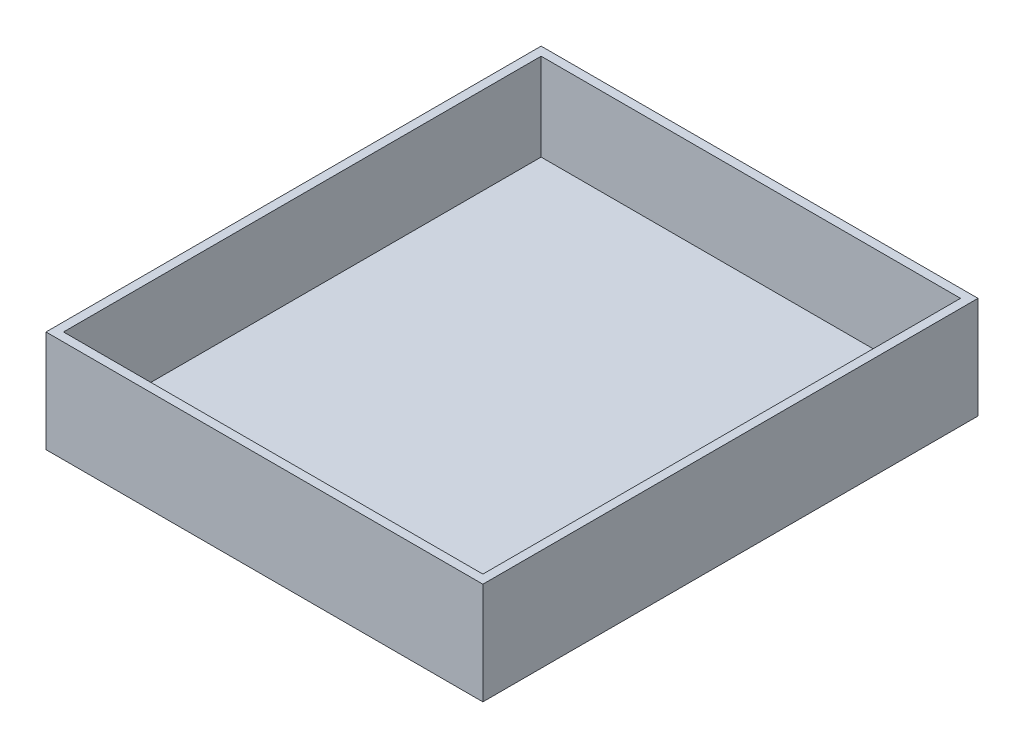
from build123d import *

# Parameters (mm, degrees)
SKETCH1_W           = 150
SKETCH1_H           = 170
BOSS_EXTRUDE1_DEPTH = 5
SKETCH3_W           = 150
SKETCH3_H           = 170
SKETCH3_W_2         = 144
SKETCH3_H_2         = 164
BOSS_EXTRUDE3_DEPTH = 30


with BuildPart() as part:
    # Sketch1 → Boss-Extrude1 (new body)
    with BuildSketch(Plane(origin=(0, 0, 0), x_dir=(1, 0, 0), z_dir=(0, 1, 0))):
        Rectangle(SKETCH1_W, SKETCH1_H)
    extrude(amount=BOSS_EXTRUDE1_DEPTH)

    # Sketch3 → Boss-Extrude3 (add)
    with BuildSketch(Plane(origin=(0, 5, 0), x_dir=(1, 0, 0), z_dir=(0, 1, 0))):
        Rectangle(SKETCH3_W, SKETCH3_H)
        Rectangle(SKETCH3_W_2, SKETCH3_H_2, mode=Mode.SUBTRACT)
    extrude(amount=BOSS_EXTRUDE3_DEPTH)


solid = part.part
